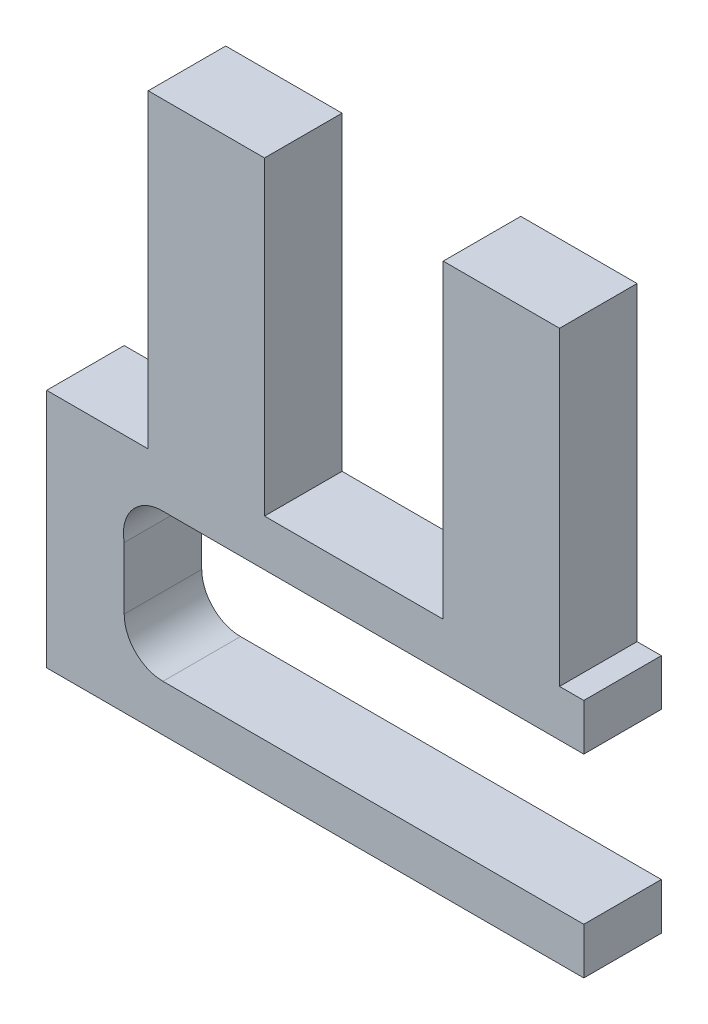
from build123d import *

# Parameters (mm, degrees)
EXTRUDE_1_DEPTH = 10


with BuildPart() as part:
    # 草圖1 → 填料-伸長1 (new body)
    with BuildSketch(Plane.XY):
        with BuildLine():
            Line((7.459969379, 7.418851377), (61.73005582, 7.418851377))
            Line((61.73005582, 7.418851377), (61.73005582, 1.418851377))
            Line((61.73005582, 1.418851377), (-7.540030621, 1.418851377))
            Line((-7.540030621, 1.418851377), (-7.540030621, 22.324714328))
            Line((-7.540030621, 22.324714328), (-7.540030621, 32.418851377))
            Line((-7.540030621, 32.418851377), (5.553208045, 32.418851377))
            Line((5.553208045, 32.418851377), (5.553208045, 72.418851377))
            Line((5.553208045, 72.418851377), (20.553208045, 72.418851377))
            Line((20.553208045, 72.418851377), (20.553208045, 32.418851377))
            Line((20.553208045, 32.418851377), (43.60119499, 32.418851377))
            Line((43.60119499, 32.418851377), (43.60119499, 72.418851377))
            Line((43.60119499, 72.418851377), (58.60119499, 72.418851377))
            Line((58.60119499, 72.418851377), (58.60119499, 32.418851377))
            Line((58.60119499, 32.418851377), (61.73005582, 32.418851377))
            Line((61.73005582, 32.418851377), (61.73005582, 26.418851377))
            Line((61.73005582, 26.418851377), (7.459969379, 26.418851377))
            ThreePointArc((7.459969379, 26.418851377), (3.517633158, 24.620798228), (2.459969379, 20.418851377))
            Line((2.459969379, 20.418851377), (2.459969379, 12.418851377))
            ThreePointArc((2.459969379, 12.418851377), (3.924435473, 8.883317471), (7.459969379, 7.418851377))
        make_face()
    extrude(amount=EXTRUDE_1_DEPTH)


solid = part.part
